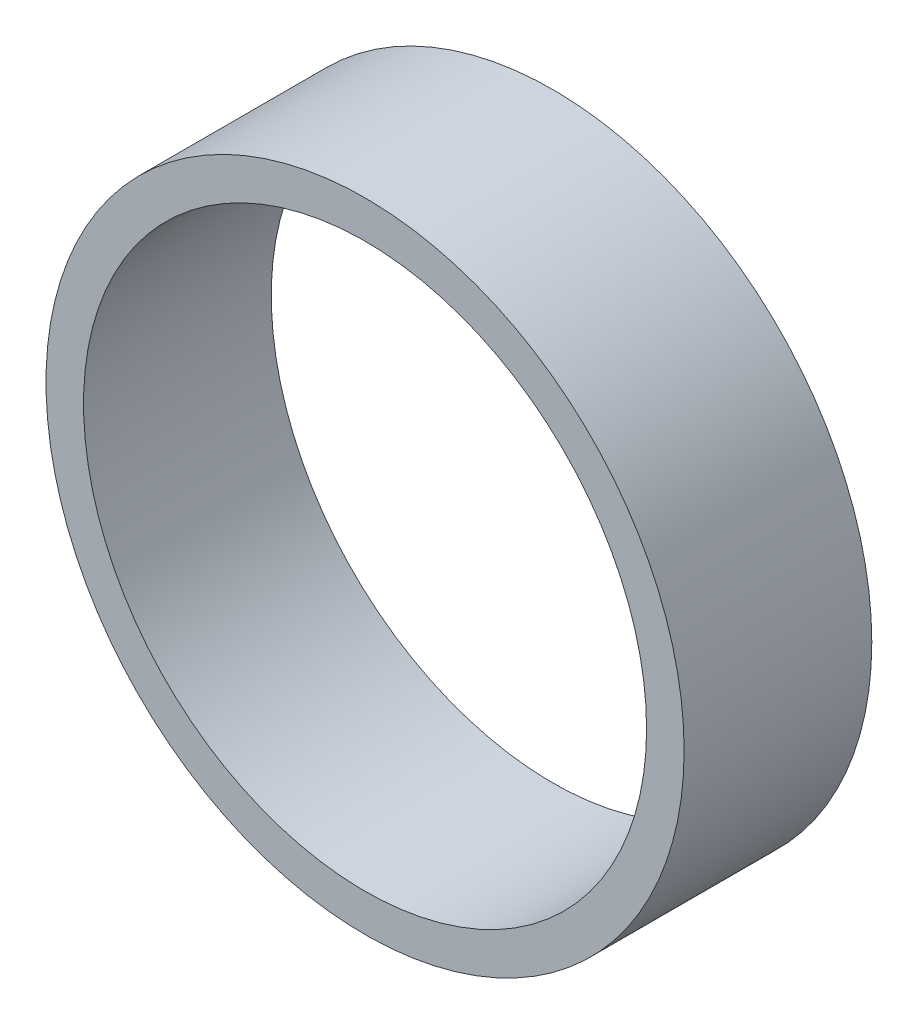
from build123d import *

# Parameters (mm, degrees)
ESBO_O1_R                = 85
ESBO_O1_R_2              = 75
RESSALTO_EXTRUS_O2_DEPTH = 50


with BuildPart() as part:
    # Esboço1 → Ressalto-extrusão2 (new body)
    with BuildSketch(Plane.XY):
        Circle(ESBO_O1_R)
        Circle(ESBO_O1_R_2, mode=Mode.SUBTRACT)
    extrude(amount=RESSALTO_EXTRUS_O2_DEPTH)


solid = part.part
